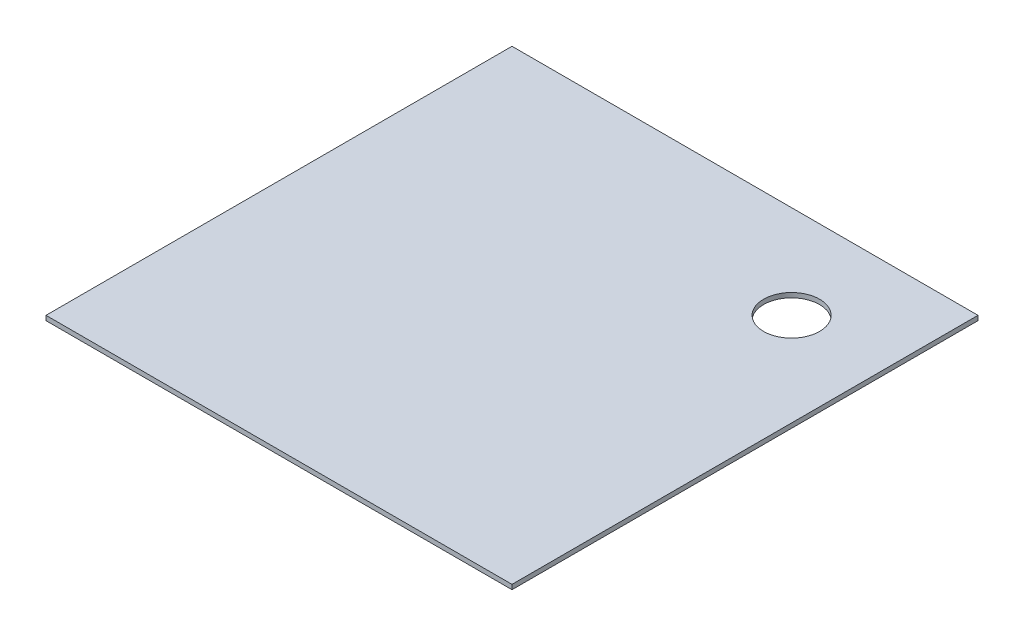
from build123d import *

# Parameters (mm, degrees)
SKETCH1_W           = 50
SKETCH1_H           = 50
SKETCH1_R           = 3
BOSS_EXTRUDE1_DEPTH = 0.25


with BuildPart() as part:
    # Sketch1 → Boss-Extrude1 (new, symmetric)
    with BuildSketch(Plane(origin=(0, 0, 0), x_dir=(1, 0, 0), z_dir=(0, 1, 0))):
        Rectangle(SKETCH1_W, SKETCH1_H)
        with Locations(Location((15, 15, 0), (0, 0, 270))):
            Circle(SKETCH1_R, mode=Mode.SUBTRACT)
    extrude(amount=BOSS_EXTRUDE1_DEPTH, both=True)


solid = part.part
